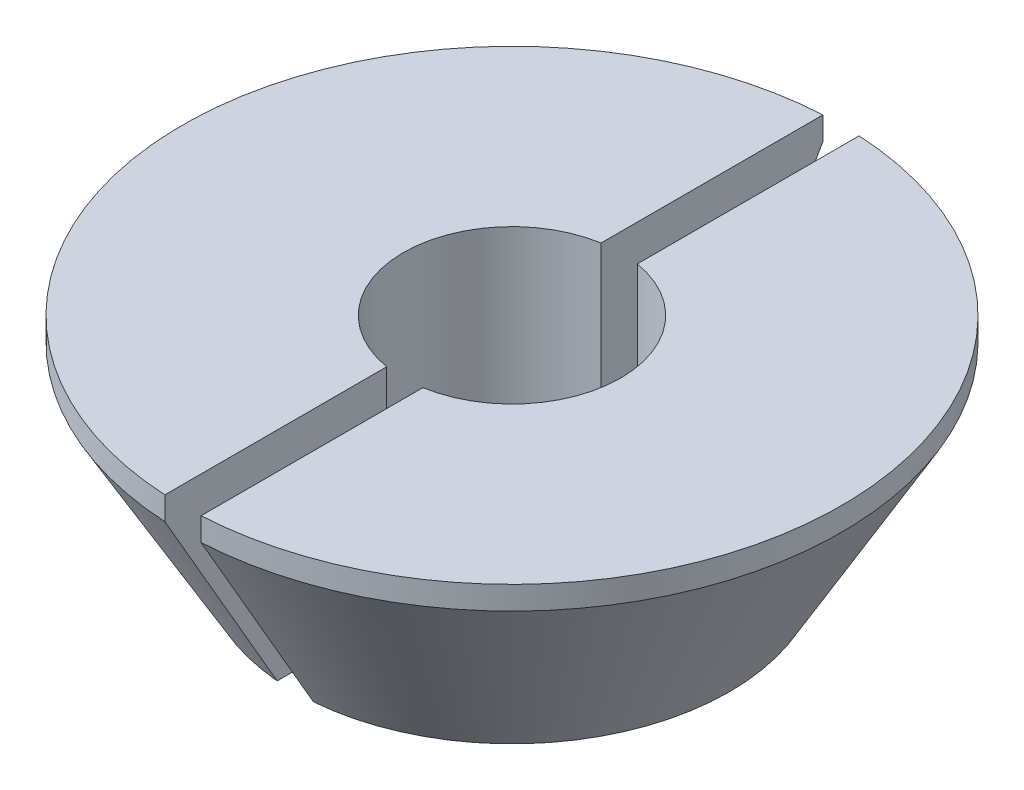
from build123d import *

# Parameters (mm, degrees)
SKETCH2_W          = 0.5
SKETCH2_H          = 10
CUT_EXTRUDE2_DEPTH = 10


with BuildPart() as part:
    # Sketch1 → Revolve1 (revolve)
    with BuildSketch(Plane.XY, mode=Mode.PRIVATE) as revolve1_sk:
        Polygon((1.5, 0), (3, 0), (4.547298721, 2.68), (4.547298721, 3), (1.5, 3), align=None)
    revolve(revolve1_sk.sketch.rotate(Axis((0, 0, 0), (0, 1, 0)), 90), axis=Axis((0, 0, 0), (0, 1, 0)))

    # Sketch2 → Cut-Extrude2 (cut)
    with BuildSketch(Plane(origin=(0, 3, 0), x_dir=(1, 0, 0), z_dir=(0, 1, 0))):
        Rectangle(SKETCH2_W, SKETCH2_H)
    extrude(amount=-CUT_EXTRUDE2_DEPTH, mode=Mode.SUBTRACT)


with BuildPart() as cut_extrude2_piece_1:
    # of the separate pieces the step leaves, piece 1, a body of its own (cut_extrude2_pieces)
    add(part.part.solids().sort_by_distance((0.25, 0, 1.479019946))[0])


with BuildPart() as cut_extrude2_piece_2:
    # of the separate pieces the step leaves, piece 2, a body of its own (cut_extrude2_pieces)
    add(part.part.solids().sort_by_distance((-0.25, 0, -2.989565186))[0])


solid = Compound([cut_extrude2_piece_1.part, cut_extrude2_piece_2.part])
